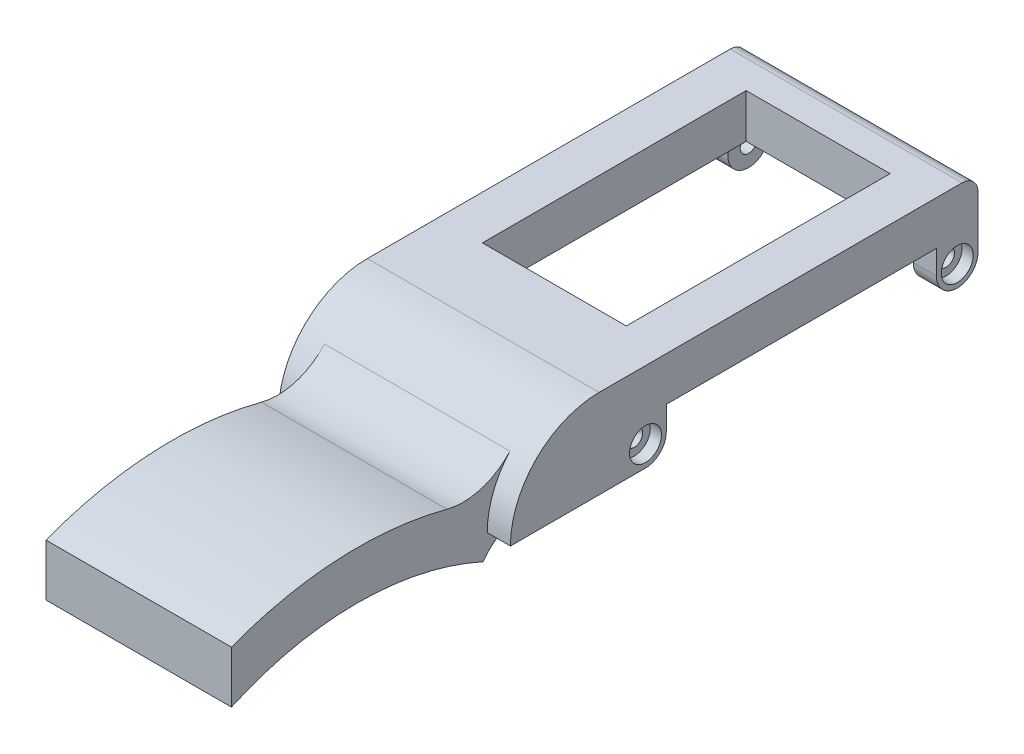
from build123d import *

# Parameters (mm, degrees)
SKETCH1_W                       = 29
SKETCH1_H                       = 44
SKETCH1_W_2                     = 18
SKETCH1_H_2                     = 33
BOSS_EXTRUDE1_DEPTH             = 5.5
SKETCH2_R                       = 1.05
BOSS_EXTRUDE2_DEPTH             = 2.9
SKETCH2_4_R                     = 2
SKETCH2_4_R_2                   = 1.05
CUT_EXTRUDE1_DEPTH              = 1.4
BOSS_EXTRUDE4_REACH             = 41.672
BOSS_EXTRUDE4_DIRECTION_2_REACH = 41.672
FILLET1_R                       = 2


with BuildPart() as part:
    # Sketch1 → Boss-Extrude1 (new body)
    with BuildSketch(Plane(origin=(0, 0, 0), x_dir=(1, 0, 0), z_dir=(0, 1, 0))):
        Rectangle(SKETCH1_W, SKETCH1_H)
        Rectangle(SKETCH1_W_2, SKETCH1_H_2, mode=Mode.SUBTRACT)
    extrude(amount=BOSS_EXTRUDE1_DEPTH)

    # Sketch2 → Boss-Extrude2 (add)
    # profile 1 of 2: a face of its own
    with BuildSketch(Plane(origin=(14.5, 0, 0), x_dir=(0, 0, -1), z_dir=(1, 0, 0))):
        with BuildLine():
            Line((-17, -3), (-17, 0))
            Line((-17, 0), (-22, 0))
            Line((-22, 0), (-22, 5.5))
            Line((-22, 5.5), (-25.4, 5.5))
            ThreePointArc((-25.4, 5.5), (-33.248885271, 2.248885271), (-36.5, -5.6))
            Line((-36.5, -5.6), (-19.6, -5.6))
            ThreePointArc((-19.6, -5.6), (-17.761522369, -4.838477631), (-17, -3))
        make_face()
        with Locations((-19.6, -3)):
            Circle(SKETCH2_R, mode=Mode.SUBTRACT)
    # profile 2 of 2: a face of its own
    with BuildSketch(Plane(origin=(14.5, 0, 0), x_dir=(0, 0, -1), z_dir=(1, 0, 0))):
        with BuildLine():
            Line((22, -3), (22, 0))
            Line((22, 0), (16.8, 0))
            Line((16.8, 0), (16.8, -3))
            ThreePointArc((16.8, -3), (19.4, -5.6), (22, -3))
        make_face()
        with Locations((19.4, -3)):
            Circle(SKETCH2_R, mode=Mode.SUBTRACT)
    boss_extrude2 = extrude(amount=-BOSS_EXTRUDE2_DEPTH)

    # Sketch2<4> → Cut-Extrude1 (cut)
    # profile 1 of 2: a face of its own
    with BuildSketch(Plane(origin=(14.5, 0, 0), x_dir=(0, 0, -1), z_dir=(1, 0, 0))):
        with Locations((19.4, -3)):
            Circle(SKETCH2_4_R)
        with Locations((19.4, -3)):
            Circle(SKETCH2_4_R_2, mode=Mode.SUBTRACT)
    # profile 2 of 2: a face of its own
    with BuildSketch(Plane(origin=(14.5, 0, 0), x_dir=(0, 0, -1), z_dir=(1, 0, 0))):
        with Locations((-19.6, -3)):
            Circle(SKETCH2_4_R)
        with Locations((-19.6, -3)):
            Circle(SKETCH2_4_R_2, mode=Mode.SUBTRACT)
    cut_extrude1 = extrude(amount=-CUT_EXTRUDE1_DEPTH, mode=Mode.SUBTRACT)

    # Mirror1: Boss-Extrude2, Cut-Extrude1 across plane
    add(boss_extrude2.mirror(Plane(origin=(0, 0, 0), x_dir=(0, 0, 1), z_dir=(1, 0, 0))))
    add(cut_extrude1.mirror(Plane(origin=(0, 0, 0), x_dir=(0, 0, 1), z_dir=(1, 0, 0))), mode=Mode.SUBTRACT)

    # Boss-Extrude4: up to this face of the body (flat: up to its plane)
    boss_extrude4_end = Plane(part.part.faces().sort_by_distance((-11.6, -0.943202452, 27.036803337))[0])
    # Sketch3 → Boss-Extrude4 (add, up to the picked face)
    with BuildSketch(Plane(origin=(0, 0, 0), x_dir=(0, 0, -1), z_dir=(1, 0, 0)), mode=Mode.PRIVATE) as boss_extrude4_sk1:
        with BuildLine():
            Line((-31.5, 0), (-22, 0))
            Line((-22, 0), (-22, 5.5))
            Line((-22, 5.5), (-25.4, 5.5))
            ThreePointArc((-25.4, 5.5), (-29.920514853, 4.537797861), (-33.657309154, 1.818008192))
            ThreePointArc((-33.657309154, 1.818008192), (-37.265361906, -0.468563976), (-41.536346157, -0.540330832))
            ThreePointArc((-41.536346157, -0.540330832), (-55.132701751, 0.845458827), (-68.5, -2))
            Line((-68.5, -2), (-68.5, -8.5))
            ThreePointArc((-68.5, -8.5), (-52.75, -5.090094938), (-37, -8.5))
            ThreePointArc((-37, -8.5), (-34.608858311, -6.369406651), (-31.5, -5.6))
            Line((-31.5, -5.6), (-31.5, 0))
        make_face()
    boss_extrude4_tool1 = split(extrude(boss_extrude4_sk1.sketch, amount=-BOSS_EXTRUDE4_REACH, mode=Mode.PRIVATE), bisect_by=boss_extrude4_end, keep=Keep.BOTH, mode=Mode.PRIVATE)
    add(boss_extrude4_tool1.solids().sort_by(Axis((0, -2.060248, 45.404241), (-1, 0, 0)))[0])

    # Boss-Extrude4 direction 2: up to this face of the body (flat: up to its plane)
    boss_extrude4_direction_2_end = Plane(part.part.faces().sort_by_distance((11.6, -0.943202452, 27.036803337))[0])
    # Sketch3 → Boss-Extrude4 direction 2 (add, up to the picked face)
    with BuildSketch(Plane(origin=(0, 0, 0), x_dir=(0, 0, -1), z_dir=(1, 0, 0)), mode=Mode.PRIVATE) as boss_extrude4_direction_2_sk1:
        with BuildLine():
            Line((-31.5, 0), (-22, 0))
            Line((-22, 0), (-22, 5.5))
            Line((-22, 5.5), (-25.4, 5.5))
            ThreePointArc((-25.4, 5.5), (-29.920514853, 4.537797861), (-33.657309154, 1.818008192))
            ThreePointArc((-33.657309154, 1.818008192), (-37.265361906, -0.468563976), (-41.536346157, -0.540330832))
            ThreePointArc((-41.536346157, -0.540330832), (-55.132701751, 0.845458827), (-68.5, -2))
            Line((-68.5, -2), (-68.5, -8.5))
            ThreePointArc((-68.5, -8.5), (-52.75, -5.090094938), (-37, -8.5))
            ThreePointArc((-37, -8.5), (-34.608858311, -6.369406651), (-31.5, -5.6))
            Line((-31.5, -5.6), (-31.5, 0))
        make_face()
    boss_extrude4_direction_2_tool1 = split(extrude(boss_extrude4_direction_2_sk1.sketch, amount=BOSS_EXTRUDE4_DIRECTION_2_REACH, mode=Mode.PRIVATE), bisect_by=boss_extrude4_direction_2_end, keep=Keep.BOTH, mode=Mode.PRIVATE)
    add(boss_extrude4_direction_2_tool1.solids().sort_by(Axis((0, -2.060248, 45.404241), (1, 0, 0)))[0])

    # Fillet1
    fillet1_edges = [part.edges().sort_by_distance(p)[0] for p in [
        (0, 5.5, -22),
    ]]
    fillet(fillet1_edges, radius=FILLET1_R)


solid = part.part
